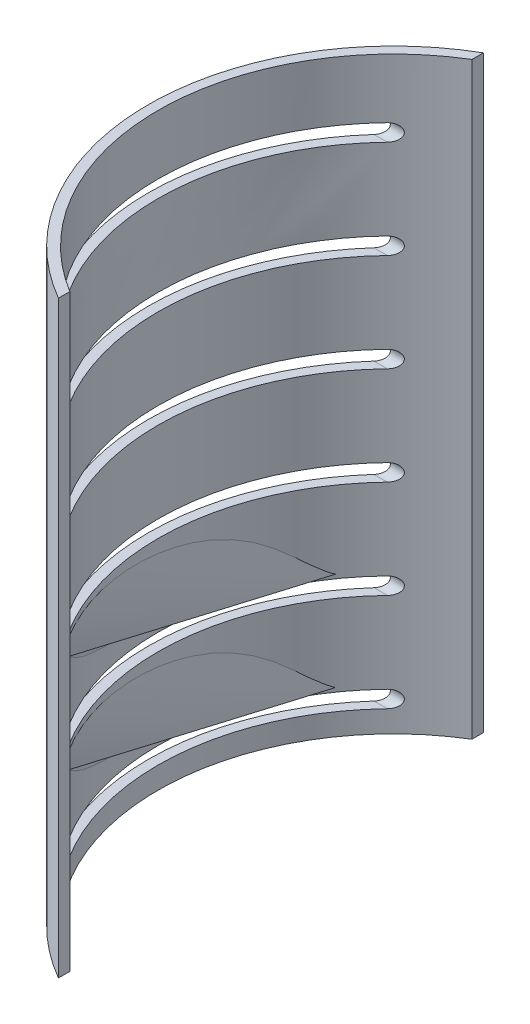
from build123d import *

# Parameters (mm, degrees)
BOSS_EXTRUDE1_DEPTH     = 60
CUT_EXTRUDE1_DEPTH      = 69.51094803
CUT_EXTRUDE1_DEPTH_BACK = 69.51094803


with BuildPart() as part:
    # Sketch2 → Boss-Extrude1 (new body)
    with BuildSketch(Plane(origin=(0, 0, 0), x_dir=(1, 0, 0), z_dir=(0, 1, 0))):
        with BuildLine():
            Line((-12.5, 21.650635095), (-12.5, 20.487801249))
            ThreePointArc((-12.5, 20.487801249), (-24, 0), (-12.5, -20.487801249))
            Line((-12.5, -20.487801249), (-12.5, -21.650635095))
            ThreePointArc((-12.5, -21.650635095), (-25, 0), (-12.5, 21.650635095))
        make_face()
    extrude(amount=BOSS_EXTRUDE1_DEPTH)

    # Sketch3 → Cut-Extrude1 (cut, two sides: drawn at the far end of the back side and taken through both)
    with BuildSketch(Plane(origin=(0, 0, 0), x_dir=(0, 0, -1), z_dir=(1, 0, 0)).offset(-CUT_EXTRUDE1_DEPTH_BACK)):
        with BuildLine():
            Line((-16.650635095, 3.941343908), (16.650635095, 3.941343908))
            ThreePointArc((16.650635095, 3.941343908), (17.511307049, 3.080671954), (16.650635095, 2.22))
            Line((16.650635095, 2.22), (-16.650635095, 2.22))
            ThreePointArc((-16.650635095, 2.22), (-17.511307049, 3.080671954), (-16.650635095, 3.941343908))
        make_face()
        with BuildLine():
            Line((-16.650635095, 13.941343908), (16.650635095, 13.941343908))
            ThreePointArc((16.650635095, 13.941343908), (17.511307049, 13.080671954), (16.650635095, 12.22))
            Line((16.650635095, 12.22), (-16.650635095, 12.22))
            ThreePointArc((-16.650635095, 12.22), (-17.511307049, 13.080671954), (-16.650635095, 13.941343908))
        make_face()
        with BuildLine():
            Line((-16.650635095, 23.941343908), (16.650635095, 23.941343908))
            ThreePointArc((16.650635095, 23.941343908), (17.511307049, 23.080671954), (16.650635095, 22.22))
            Line((16.650635095, 22.22), (-16.650635095, 22.22))
            ThreePointArc((-16.650635095, 22.22), (-17.511307049, 23.080671954), (-16.650635095, 23.941343908))
        make_face()
        with BuildLine():
            Line((-16.650635095, 33.941343908), (16.650635095, 33.941343908))
            ThreePointArc((16.650635095, 33.941343908), (17.511307049, 33.080671954), (16.650635095, 32.22))
            Line((16.650635095, 32.22), (-16.650635095, 32.22))
            ThreePointArc((-16.650635095, 32.22), (-17.511307049, 33.080671954), (-16.650635095, 33.941343908))
        make_face()
        with BuildLine():
            Line((-16.650635095, 43.941343908), (16.650635095, 43.941343908))
            ThreePointArc((16.650635095, 43.941343908), (17.511307049, 43.080671954), (16.650635095, 42.22))
            Line((16.650635095, 42.22), (-16.650635095, 42.22))
            ThreePointArc((-16.650635095, 42.22), (-17.511307049, 43.080671954), (-16.650635095, 43.941343908))
        make_face()
        with BuildLine():
            Line((-16.650635095, 53.941343908), (16.650635095, 53.941343908))
            ThreePointArc((16.650635095, 53.941343908), (17.511307049, 53.080671954), (16.650635095, 52.22))
            Line((16.650635095, 52.22), (-16.650635095, 52.22))
            ThreePointArc((-16.650635095, 52.22), (-17.511307049, 53.080671954), (-16.650635095, 53.941343908))
        make_face()
    extrude(amount=CUT_EXTRUDE1_DEPTH + CUT_EXTRUDE1_DEPTH_BACK, mode=Mode.SUBTRACT)


solid = part.part
